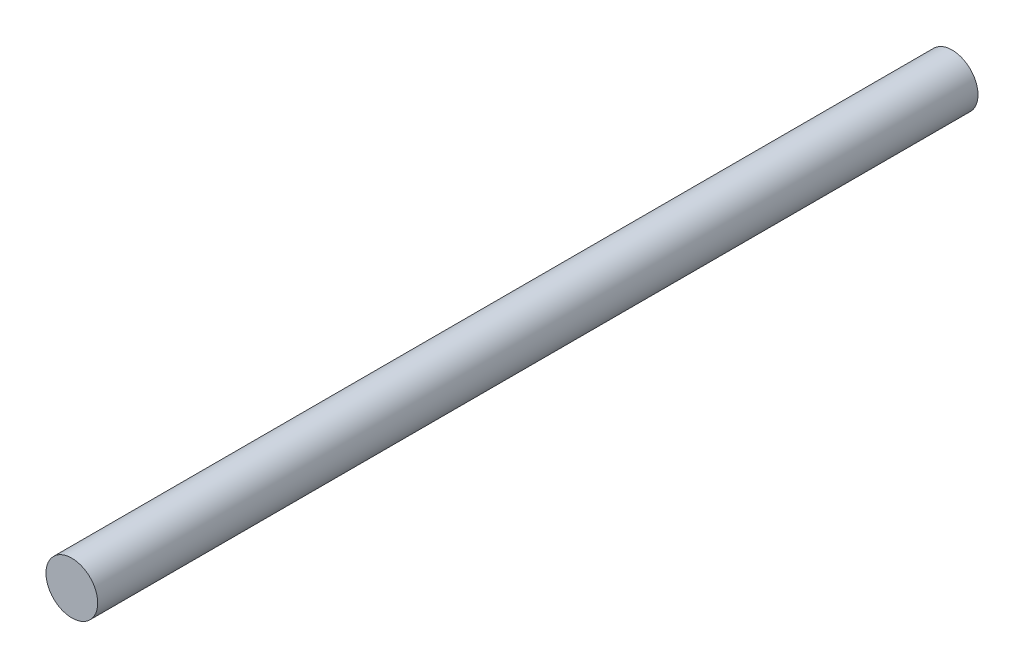
from build123d import *

# Parameters (mm, degrees)
ESQUISSE1_R        = 10
BOSS_EXTRU_1_DEPTH = 340


with BuildPart() as part:
    # Esquisse1 → Boss.-Extru.1 (new body)
    with BuildSketch(Plane.XY):
        Circle(ESQUISSE1_R)
    extrude(amount=BOSS_EXTRU_1_DEPTH)


solid = part.part
